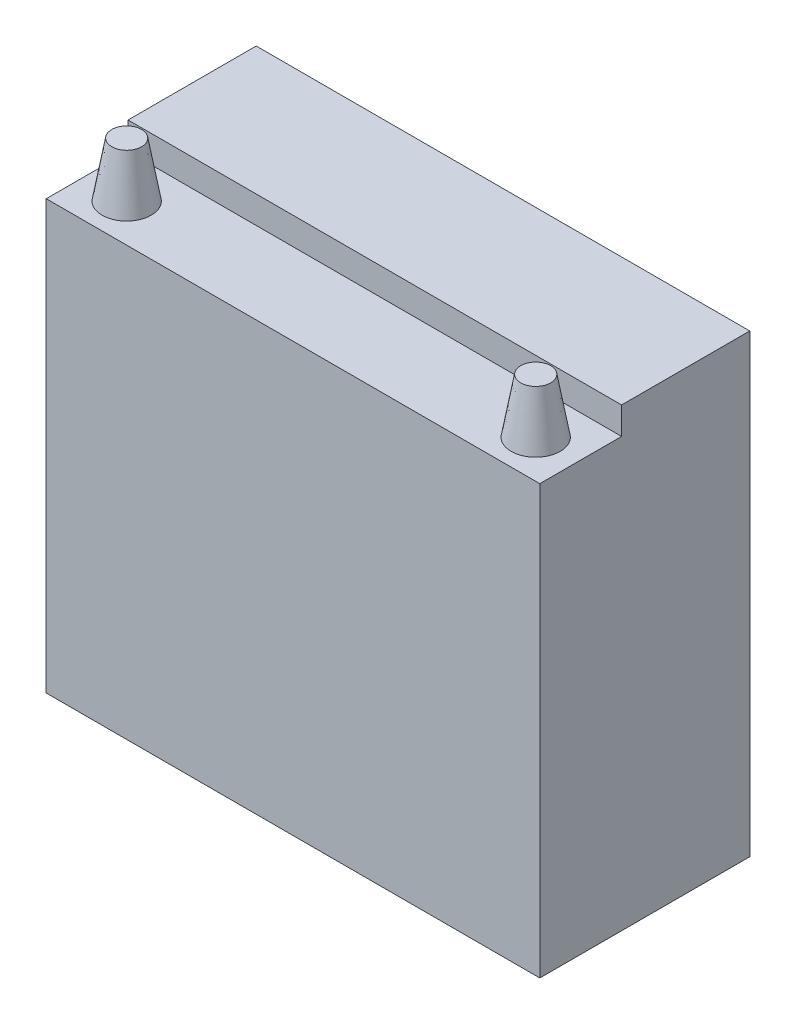
from build123d import *

# Parameters (mm, degrees)
ESBO_O1_W                          = 181
ESBO_O1_H                          = 77
RESSALTO_EXTRUS_O1_DEPTH           = 167
ESBO_O2_W                          = 181
ESBO_O2_H                          = 30
CORTE_EXTRUS_O1_DEPTH              = 10
ESBO_O3_R                          = 9
RESSALTO_EXTRUS_O2_DEPTH           = 20
RESSALTO_EXTRUS_O2_DRAFT           = 10
RESSALTO_EXTRUS_O2_PROFILE_2_DEPTH = 20
RESSALTO_EXTRUS_O2_PROFILE_2_DRAFT = 10


with BuildPart() as part:
    # Esboço1 → Ressalto-extrusão1 (new body)
    with BuildSketch(Plane(origin=(0, 0, 0), x_dir=(1, 0, 0), z_dir=(0, 1, 0))):
        with Locations((13.5, 6.669291339)):
            Rectangle(ESBO_O1_W, ESBO_O1_H)
    extrude(amount=RESSALTO_EXTRUS_O1_DEPTH)

    # Esboço2 → Corte-extrusão1 (cut)
    with BuildSketch(Plane(origin=(0, 167, 0), x_dir=(1, 0, 0), z_dir=(0, 1, 0))):
        with Locations((13.5, -16.830708661)):
            Rectangle(ESBO_O2_W, ESBO_O2_H)
    extrude(amount=-CORTE_EXTRUS_O1_DEPTH, mode=Mode.SUBTRACT)


with BuildPart() as ressalto_extrus_o2_tool:
    # Esboço3 → Ressalto-extrusão2 (with draft: the straight prism first)
    with BuildSketch(Plane(origin=(0, 157, 0), x_dir=(1, 0, 0), z_dir=(0, 1, 0))):
        with Locations((-61.5, -17.830708661)):
            Circle(ESBO_O3_R)
    extrude(amount=RESSALTO_EXTRUS_O2_DEPTH)
    # Ressalto-extrusão2: the draft: its side faces are tilted about the plane it starts from
    ressalto_extrus_o2_sides = [ressalto_extrus_o2_tool.faces().sort_by_distance(p)[0] for p in [
        (-70.5, 167, 17.830708661),
    ]]
    draft(ressalto_extrus_o2_sides, Plane(origin=(0, 157, 0), x_dir=(1, 0, 0), z_dir=(0, 1, 0)), RESSALTO_EXTRUS_O2_DRAFT)


with BuildPart() as part_1:
    add(part.part)

    # Ressalto-extrusão2: add ressalto_extrus_o2_tool
    add(ressalto_extrus_o2_tool.part)


with BuildPart() as ressalto_extrus_o2_profile_2_tool:
    # Esboço3 → Ressalto-extrusão2 profile 2 (with draft: the straight prism first)
    with BuildSketch(Plane(origin=(0, 157, 0), x_dir=(1, 0, 0), z_dir=(0, 1, 0))):
        with Locations((88.5, -17.830708661)):
            Circle(ESBO_O3_R)
    extrude(amount=RESSALTO_EXTRUS_O2_PROFILE_2_DEPTH)
    # Ressalto-extrusão2 profile 2: the draft: its side faces are tilted about the plane it starts from
    ressalto_extrus_o2_profile_2_sides = [ressalto_extrus_o2_profile_2_tool.faces().sort_by_distance(p)[0] for p in [
        (79.5, 167, 17.830708661),
    ]]
    draft(ressalto_extrus_o2_profile_2_sides, Plane(origin=(0, 157, 0), x_dir=(1, 0, 0), z_dir=(0, 1, 0)), RESSALTO_EXTRUS_O2_PROFILE_2_DRAFT)


with BuildPart() as part_2:
    add(part_1.part)

    # Ressalto-extrusão2 profile 2: add ressalto_extrus_o2_profile_2_tool
    add(ressalto_extrus_o2_profile_2_tool.part)


solid = part_2.part
